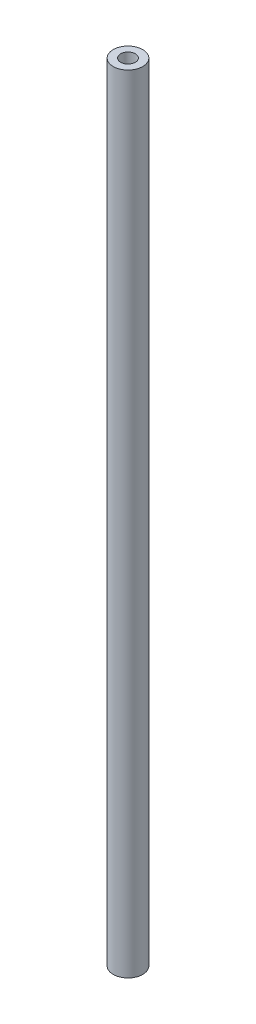
from build123d import *

# Parameters (mm, degrees)
SKETCH1_R           = 3
SKETCH1_R_2         = 1.5
BOSS_EXTRUDE1_DEPTH = 160
SKETCH2_R           = 3
BOSS_EXTRUDE2_DEPTH = 5


with BuildPart() as part:
    # Sketch1 → Boss-Extrude1 (new body)
    with BuildSketch(Plane(origin=(0, 0, 0), x_dir=(1, 0, 0), z_dir=(0, 1, 0))):
        with Locations(Location((0, 0, 0), (0, 0, 270))):
            Circle(SKETCH1_R)
        with Locations(Location((0, 0, 0), (0, 0, 270))):
            Circle(SKETCH1_R_2, mode=Mode.SUBTRACT)
    extrude(amount=BOSS_EXTRUDE1_DEPTH)

    # Sketch2 → Boss-Extrude2 (add)
    with BuildSketch(Plane.XZ):
        with Locations(Location((0, 0, 0), (0, 0, 90))):
            Circle(SKETCH2_R)
    extrude(amount=-BOSS_EXTRUDE2_DEPTH)


solid = part.part
